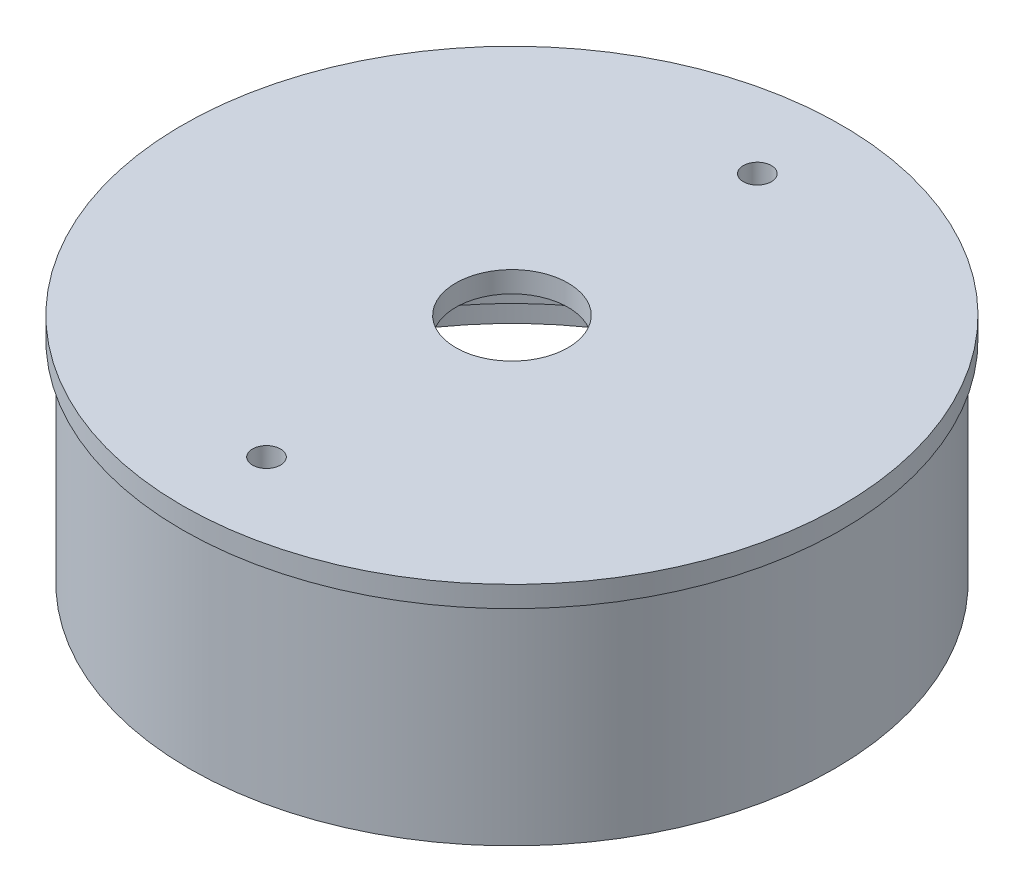
from build123d import *

# Parameters (mm, degrees)
SKETCH1_R           = 46
SKETCH1_R_2         = 45.25
BOSS_EXTRUDE1_DEPTH = 30
SKETCH3_R           = 47
BOSS_EXTRUDE2_DEPTH = 3
SKETCH4_R           = 2
SKETCH4_R_2         = 8
CUT_EXTRUDE1_DEPTH  = 75.209163855
BOSS_EXTRUDE3_START = 27
SKETCH5_R           = 45.25
SKETCH5_R_2         = 44.5
BOSS_EXTRUDE3_DEPTH = 27


with BuildPart() as part:
    # Sketch1 → Boss-Extrude1 (new body)
    with BuildSketch(Plane(origin=(0, 0, 0), x_dir=(1, 0, 0), z_dir=(0, 1, 0))):
        with Locations(Location((0, 0, 0), (0, 0, 270))):
            Circle(SKETCH1_R)
        with Locations(Location((0, 0, 0), (0, 0, 270))):
            Circle(SKETCH1_R_2, mode=Mode.SUBTRACT)
    extrude(amount=BOSS_EXTRUDE1_DEPTH)

    # Sketch3 → Boss-Extrude2 (add)
    with BuildSketch(Plane(origin=(0, 30, 0), x_dir=(1, 0, 0), z_dir=(0, 1, 0))):
        with Locations(Location((0, 0, 0), (0, 0, 270))):
            Circle(SKETCH3_R)
    extrude(amount=BOSS_EXTRUDE2_DEPTH)

    # Sketch4 → Cut-Extrude1 (cut, through all)
    with BuildSketch(Plane(origin=(0, 33, 0), x_dir=(1, 0, 0), z_dir=(0, 1, 0))):
        with Locations(Location((0, 35, 0), (0, 0, 270))):
            Circle(SKETCH4_R)
        with Locations(Location((0, -35, 0), (0, 0, 270))):
            Circle(SKETCH4_R)
        with Locations(Location((0, 0, 0), (0, 0, 270))):
            Circle(SKETCH4_R_2)
    extrude(amount=-CUT_EXTRUDE1_DEPTH, mode=Mode.SUBTRACT)

    # Sketch5 → Boss-Extrude3 (add)
    with BuildSketch(Plane.XZ.offset(-30).offset(BOSS_EXTRUDE3_START)):
        with Locations(Location((0, 0, 0), (0, 0, 270))):
            Circle(SKETCH5_R)
        with Locations(Location((0, 0, 0), (0, 0, 270))):
            Circle(SKETCH5_R_2, mode=Mode.SUBTRACT)
    extrude(amount=-BOSS_EXTRUDE3_DEPTH)


solid = part.part
